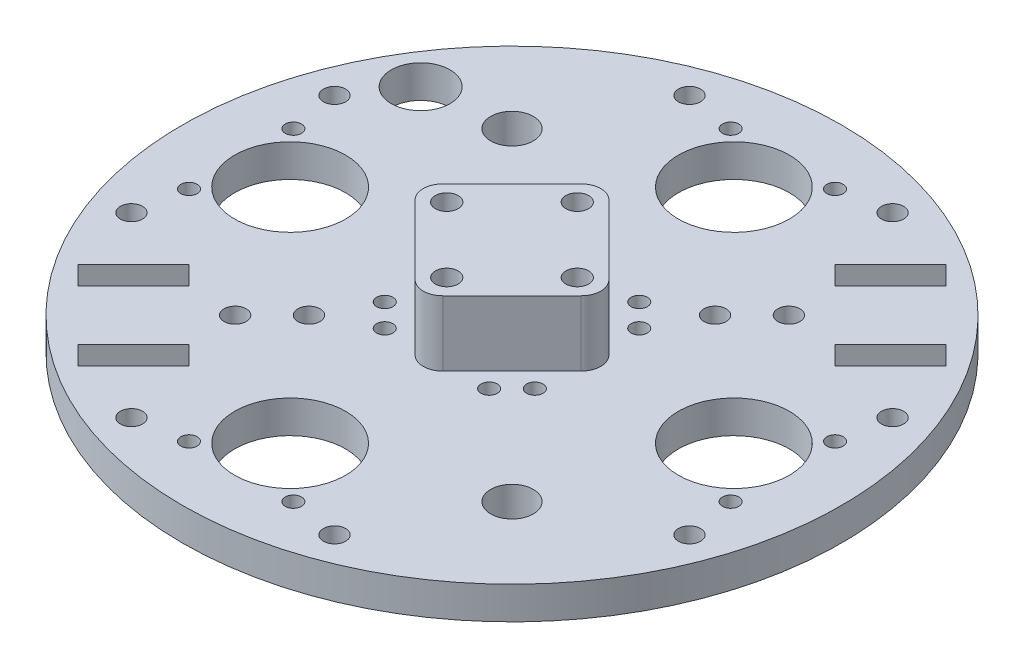
from build123d import *

# Parameters (mm, degrees)
SKETCH1_R           = 50.5
BOSS_EXTRUDE1_DEPTH = 5
SKETCH2_R           = 8.5
SKETCH2_R_2         = 1.25
CUT_EXTRUDE1_DEPTH  = 72.592597383
CIRPATTERN1_COUNT   = 4
SKETCH3_R           = 1.75
BOSS_EXTRUDE2_DEPTH = 10
FILLET2_R           = 3
SKETCH4_R           = 1.7
SKETCH4_R_2         = 3.2639
CUT_EXTRUDE2_DEPTH  = 73.114492302
SKETCH7_R           = 4.5
CUT_EXTRUDE9_DEPTH  = 73.97602346
SKETCH8_R           = 1.7
CUT_EXTRUDE10_DEPTH = 73.97602346
CIRPATTERN2_COUNT   = 4


with BuildPart() as part:
    # Sketch1 → Boss-Extrude1 (new body)
    with BuildSketch(Plane(origin=(0, 0, 0), x_dir=(1, 0, 0), z_dir=(0, 1, 0))):
        Circle(SKETCH1_R)
    extrude(amount=BOSS_EXTRUDE1_DEPTH)

    # Sketch2 → Cut-Extrude1 (cut, through all)
    with BuildSketch(Plane(origin=(0, 5, 0), x_dir=(1, 0, 0), z_dir=(0, 1, 0))):
        with Locations((34, 0)):
            Circle(SKETCH2_R)
        with Locations((41.5, -8)):
            Circle(SKETCH2_R_2)
        with Locations((41.5, 8)):
            Circle(SKETCH2_R_2)
        with Locations((11.5, 8)):
            Circle(SKETCH2_R_2)
        with Locations((11.5, -8)):
            Circle(SKETCH2_R_2)
    cut_extrude1 = extrude(amount=-CUT_EXTRUDE1_DEPTH, mode=Mode.SUBTRACT)

    # CirPattern1: Cut-Extrude1 ×4 about axis
    cirpattern1_axis = Axis((0, 5, 0), (0, -1, 0))
    for i in range(1, CIRPATTERN1_COUNT):
        add(cut_extrude1.rotate(cirpattern1_axis, i * 360 / CIRPATTERN1_COUNT), mode=Mode.SUBTRACT)

    # Sketch3 → Boss-Extrude2 (add)
    with BuildSketch(Plane(origin=(0, 5, 0), x_dir=(1, 0, 0), z_dir=(0, 1, 0))):
        Polygon((0, -14.849242405), (14.849242405, 0), (0, 14.849242405), (-14.849242405, 0), align=None)
        with Locations((10, 0)):
            Circle(SKETCH3_R, mode=Mode.SUBTRACT)
        with Locations((0, -10)):
            Circle(SKETCH3_R, mode=Mode.SUBTRACT)
        with Locations((-10, 0)):
            Circle(SKETCH3_R, mode=Mode.SUBTRACT)
        with Locations((0, 10)):
            Circle(SKETCH3_R, mode=Mode.SUBTRACT)
    extrude(amount=BOSS_EXTRUDE2_DEPTH)

    # Fillet2
    fillet2_edges = [part.edges().sort_by_distance(p)[0] for p in [
        (-14.849242405, 10, 0),
        (0, 10, -14.849242405),
        (14.849242405, 10, 0),
        (0, 10, 14.849242405),
    ]]
    fillet(fillet2_edges, radius=FILLET2_R)

    # Sketch4 → Cut-Extrude2 (cut, through all)
    with BuildSketch(Plane(origin=(0, 5, 0), x_dir=(1, 0, 0), z_dir=(0, 1, 0))):
        with Locations((21.213203436, 21.213203436)):
            Circle(SKETCH4_R)
        with Locations((-21.213203436, -21.213203436)):
            Circle(SKETCH4_R)
        with Locations((-24.748737342, 24.748737342)):
            Circle(SKETCH4_R_2)
        with Locations((24.748737342, -24.748737342)):
            Circle(SKETCH4_R_2)
        with Locations((15.556349186, 15.556349186)):
            Circle(SKETCH4_R)
        with Locations((-15.556349186, -15.556349186)):
            Circle(SKETCH4_R)
        Polygon((20.859650045, 28.637824638), (29.344931419, 37.123106012), (26.516504294, 39.951533137), (18.03122292, 31.466251763), align=None)
        Polygon((31.466251763, 18.03122292), (39.951533137, 26.516504294), (37.123106012, 29.344931419), (28.637824638, 20.859650045), align=None)
        Polygon((-26.516504294, -39.951533137), (-29.344931419, -37.123106012), (-20.859650045, -28.637824638), (-18.03122292, -31.466251763), align=None)
        Polygon((-37.123106012, -29.344931419), (-39.951533137, -26.516504294), (-31.466251763, -18.03122292), (-28.637824638, -20.859650045), align=None)
    extrude(amount=-CUT_EXTRUDE2_DEPTH, mode=Mode.SUBTRACT)

    # Sketch7 → Cut-Extrude9 (cut, through all)
    with BuildSketch(Plane(origin=(0, 0, 0), x_dir=(1, 0, 0), z_dir=(0, 1, 0))):
        with Locations((-37.314116231, 23.316447626)):
            Circle(SKETCH7_R)
    extrude(amount=CUT_EXTRUDE9_DEPTH, mode=Mode.SUBTRACT)

    # Sketch8 → Cut-Extrude10 (cut, through all)
    with BuildSketch(Plane(origin=(0, 0, 0), x_dir=(1, 0, 0), z_dir=(0, 1, 0))):
        with Locations((-15.561916521, 42.756014246)):
            Circle(SKETCH8_R)
        with Locations((15.561916521, 42.756014246)):
            Circle(SKETCH8_R)
    cut_extrude10 = extrude(amount=CUT_EXTRUDE10_DEPTH, mode=Mode.SUBTRACT)

    # CirPattern2: Cut-Extrude10 ×4 about axis
    cirpattern2_axis = Axis((0, 15.75, 0), (0, -1, 0))
    for i in range(1, CIRPATTERN2_COUNT):
        add(cut_extrude10.rotate(cirpattern2_axis, i * 360 / CIRPATTERN2_COUNT), mode=Mode.SUBTRACT)


solid = part.part
